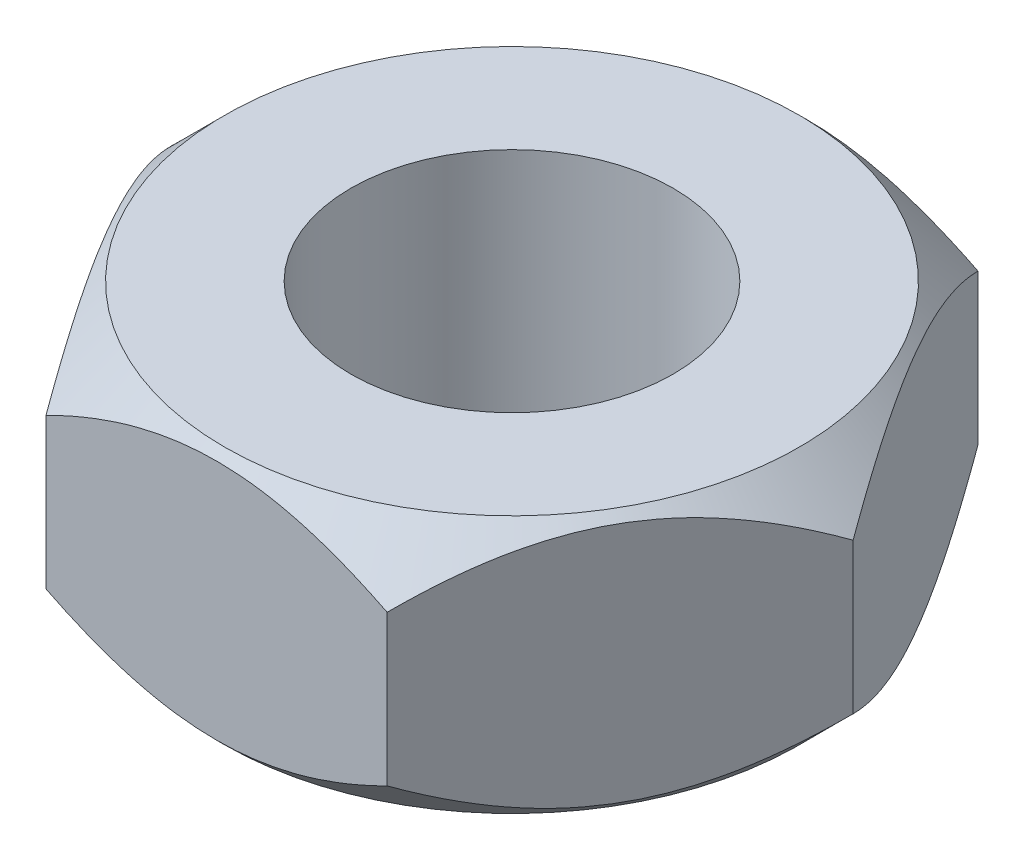
from build123d import *

# Parameters (mm, degrees)
SKETCH1_R           = 1.5
BOSS_EXTRUDE1_DEPTH = 2.4


with BuildPart() as part:
    # Sketch1 → Boss-Extrude1 (new body)
    with BuildSketch(Plane(origin=(0, 0, 0), x_dir=(1, 0, 0), z_dir=(0, 1, 0))):
        Polygon((1.58771324, 2.75), (-1.58771324, 2.75), (-3.175426481, 0), (-1.58771324, -2.75), (1.58771324, -2.75), (3.175426481, 0), align=None)
        with Locations(Location((0, 0, 0), (0, 0, 270))):
            Circle(SKETCH1_R, mode=Mode.SUBTRACT)
    extrude(amount=BOSS_EXTRUDE1_DEPTH)

    # Sketch2 → Cut-Revolve1 (revolve, cut)
    with BuildSketch(Plane.XY, mode=Mode.PRIVATE) as cut_revolve1_sk:
        Polygon((3.175426481, 0), (3.175426481, 0.5), (2.675426481, 0), align=None)
        Polygon((2.675426481, 2.4), (3.175426481, 2.4), (3.175426481, 1.9), align=None)
    revolve(cut_revolve1_sk.sketch.rotate(Axis((0, 2.4, 0), (0, -1, 0)), 300.000000219), axis=Axis((0, 2.4, 0), (0, -1, 0)), mode=Mode.SUBTRACT)


solid = part.part
